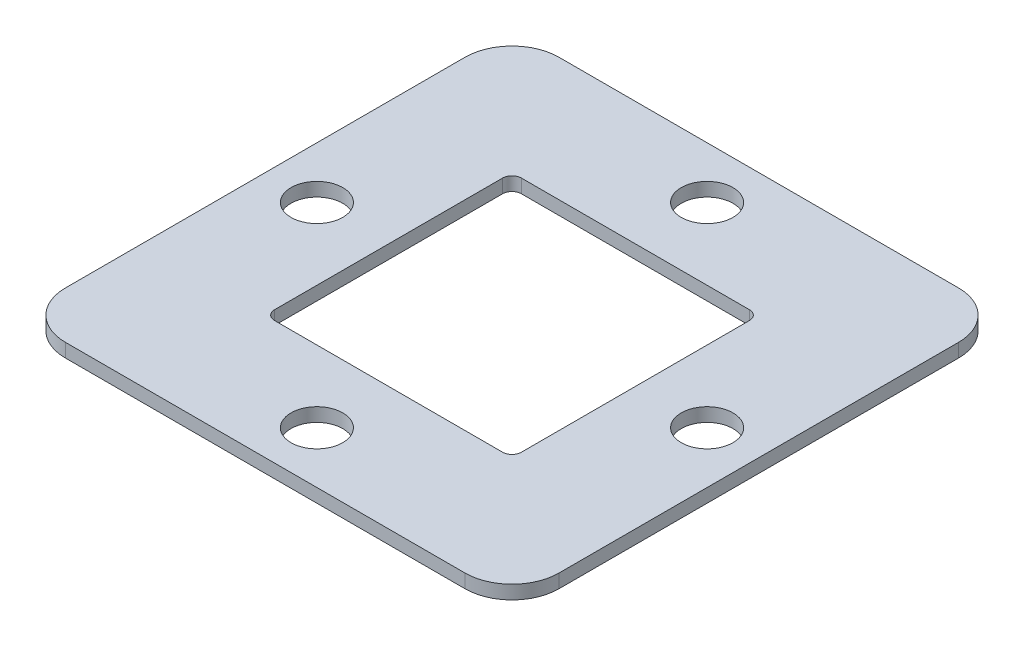
from build123d import *

# Parameters (mm, degrees)
SKETCH1_W           = 21
SKETCH1_H           = 21
BOSS_EXTRUDE1_DEPTH = 0.58
SKETCH2_W           = 10.5
SKETCH2_H           = 10.5
CUT_EXTRUDE1_DEPTH  = 15.860565265
FILLET1_R           = 2
SKETCH5_R           = 1.1
CUT_EXTRUDE5_DEPTH  = 15.860565265
FILLET2_R           = 0.4


with BuildPart() as part:
    # Sketch1 → Boss-Extrude1 (new body)
    with BuildSketch(Plane(origin=(0, 0, 0), x_dir=(1, 0, 0), z_dir=(0, 1, 0))):
        Rectangle(SKETCH1_W, SKETCH1_H)
    extrude(amount=BOSS_EXTRUDE1_DEPTH)

    # Sketch2 → Cut-Extrude1 (cut, through all)
    with BuildSketch(Plane(origin=(0, 0.58, 0), x_dir=(1, 0, 0), z_dir=(0, 1, 0))):
        Rectangle(SKETCH2_W, SKETCH2_H)
    extrude(amount=-CUT_EXTRUDE1_DEPTH, mode=Mode.SUBTRACT)

    # Fillet1
    fillet1_edges = [part.edges().sort_by_distance(p)[0] for p in [
        (10.5, 0.29, 10.5),
        (-10.5, 0.29, 10.5),
        (-10.5, 0.29, -10.5),
        (10.5, 0.29, -10.5),
    ]]
    fillet(fillet1_edges, radius=FILLET1_R)

    # Sketch5 → Cut-Extrude5 (cut, through all)
    with BuildSketch(Plane(origin=(0, 0.58, 0), x_dir=(1, 0, 0), z_dir=(0, 1, 0))):
        with Locations(Location((0, 8.3, 0), (0, 0, 270))):
            Circle(SKETCH5_R)
        with Locations(Location((8.3, 0, 0), (0, 0, 270))):
            Circle(SKETCH5_R)
        with Locations(Location((0, -8.3, 0), (0, 0, 270))):
            Circle(SKETCH5_R)
        with Locations(Location((-8.3, 0, 0), (0, 0, 270))):
            Circle(SKETCH5_R)
    extrude(amount=-CUT_EXTRUDE5_DEPTH, mode=Mode.SUBTRACT)

    # Fillet2
    fillet2_edges = [part.edges().sort_by_distance(p)[0] for p in [
        (5.25, 0.29, -5.25),
        (5.25, 0.29, 5.25),
        (-5.25, 0.29, 5.25),
        (-5.25, 0.29, -5.25),
    ]]
    fillet(fillet2_edges, radius=FILLET2_R)


solid = part.part
